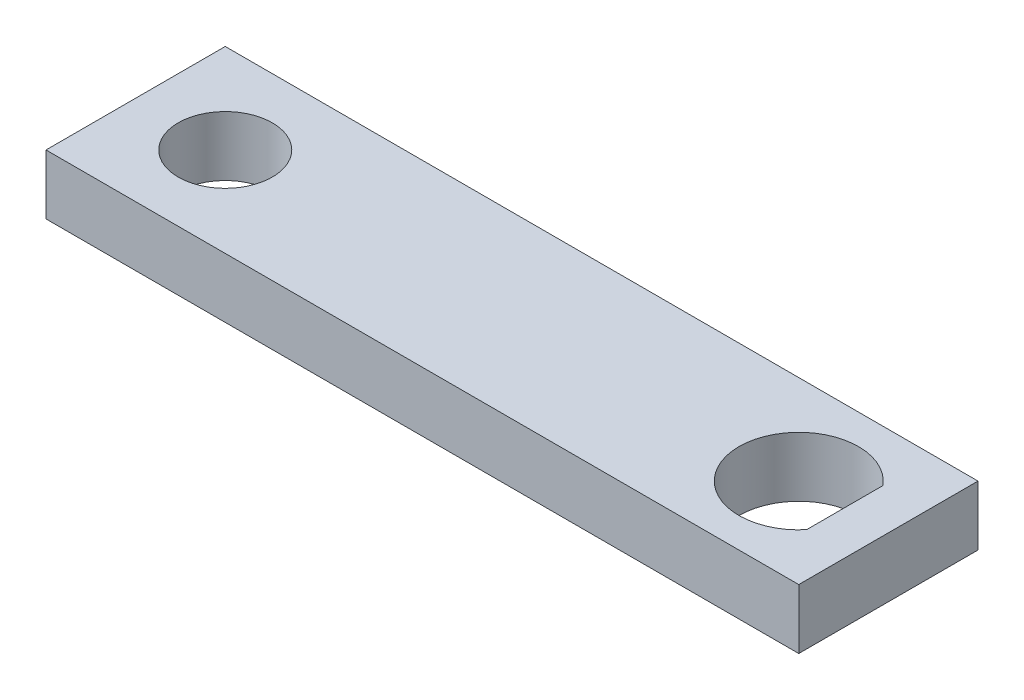
from build123d import *

# Parameters (mm, degrees)
SKETCH1_W          = 80
SKETCH1_H          = 6.35
BASE_EXTRUDE_DEPTH = 19.05
CUT_EXTRUDE1_DEPTH = 83.481664629
SKETCH3_R          = 5
CUT_EXTRUDE2_DEPTH = 83.481664629


with BuildPart() as part:
    # Sketch1 → Base-Extrude (new body)
    with BuildSketch(Plane.XY):
        with Locations((40, 3.175)):
            Rectangle(SKETCH1_W, SKETCH1_H)
    extrude(amount=BASE_EXTRUDE_DEPTH)

    # Sketch2 → Cut-Extrude1 (cut, through all)
    with BuildSketch(Plane(origin=(0, 6.35, 0), x_dir=(-1, 0, 0), z_dir=(0, 1, 0))):
        with BuildLine():
            Line((-75.3645, 5.473421326), (-75.3645, 13.576578674))
            ThreePointArc((-75.3645, 13.576578674), (-64.125, 9.525), (-75.3645, 5.473421326))
        make_face()
    extrude(amount=-CUT_EXTRUDE1_DEPTH, mode=Mode.SUBTRACT)

    # Sketch3 → Cut-Extrude2 (cut, through all)
    with BuildSketch(Plane(origin=(0, 6.35, 0), x_dir=(-1, 0, 0), z_dir=(0, 1, 0))):
        with Locations((-9.525, 9.525)):
            Circle(SKETCH3_R)
    extrude(amount=-CUT_EXTRUDE2_DEPTH, mode=Mode.SUBTRACT)


solid = part.part
